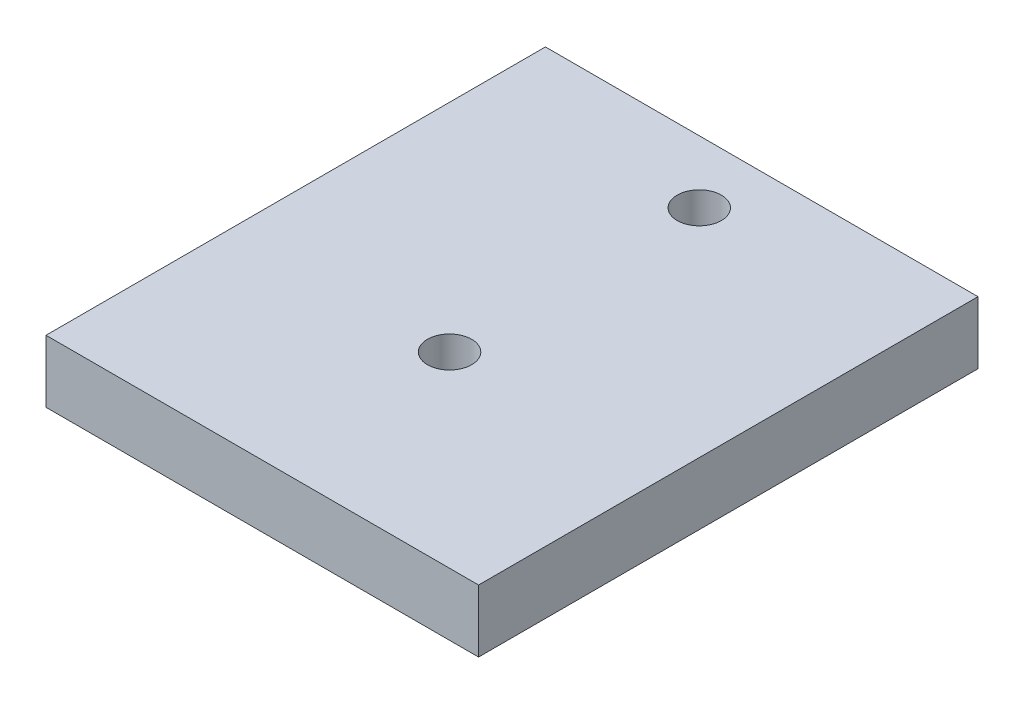
from build123d import *

# Parameters (mm, degrees)
SKETCH1_W           = 44
SKETCH1_H           = 50.8
BOSS_EXTRUDE1_DEPTH = 6.35
SKETCH2_R           = 2.2479
CUT_EXTRUDE1_DEPTH  = 35.197697291


with BuildPart() as part:
    # Sketch1 → Boss-Extrude1 (new body)
    with BuildSketch(Plane(origin=(0, 0, 0), x_dir=(1, 0, 0), z_dir=(0, 1, 0))):
        Rectangle(SKETCH1_W, SKETCH1_H)
    extrude(amount=BOSS_EXTRUDE1_DEPTH)

    # Sketch2 → Cut-Extrude1 (cut, through all)
    with BuildSketch(Plane(origin=(0, 6.35, 0), x_dir=(1, 0, 0), z_dir=(0, 1, 0))):
        with Locations(Location((0, 19.05, 0), (0, 0, 270))):
            Circle(SKETCH2_R)
        with Locations(Location((0, -6.35, 0), (0, 0, 270))):
            Circle(SKETCH2_R)
    extrude(amount=-CUT_EXTRUDE1_DEPTH, mode=Mode.SUBTRACT)


solid = part.part
